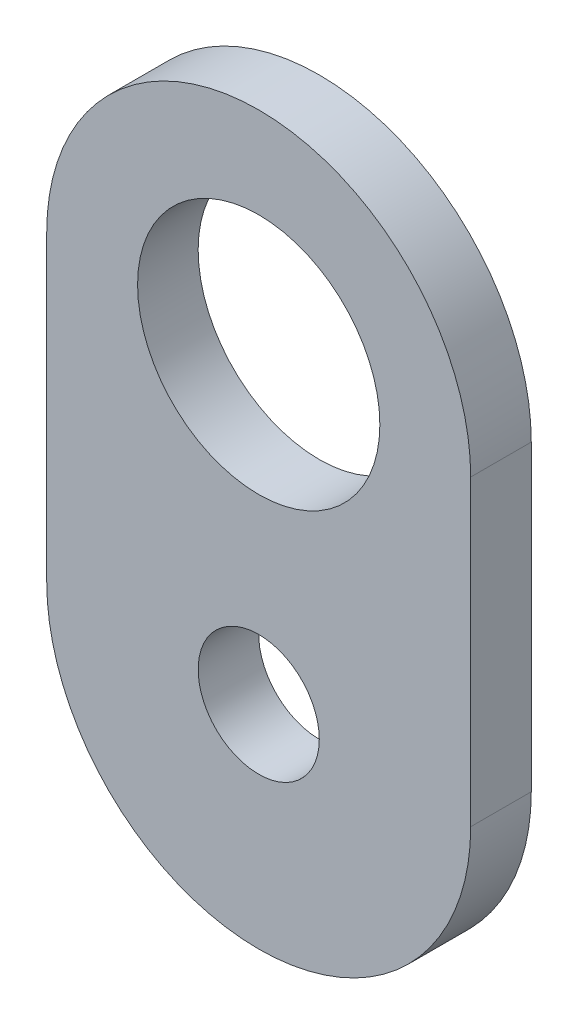
from build123d import *

# Parameters (mm, degrees)
SKETCH1_R           = 25.4
SKETCH1_R_2         = 12.7
BOSS_EXTRUDE1_DEPTH = 12.7


with BuildPart() as part:
    # Sketch1 → Boss-Extrude1 (new body)
    with BuildSketch(Plane.XY):
        with BuildLine():
            Line((-44.45, 206.731564945), (-44.45, 270.231564945))
            ThreePointArc((-44.45, 270.231564945), (0, 314.681564945), (44.45, 270.231564945))
            Line((44.45, 270.231564945), (44.45, 206.731564945))
            ThreePointArc((44.45, 206.731564945), (0, 162.281564945), (-44.45, 206.731564945))
        make_face()
        with Locations((0, 270.231564945)):
            Circle(SKETCH1_R, mode=Mode.SUBTRACT)
        with Locations((0, 206.731564945)):
            Circle(SKETCH1_R_2, mode=Mode.SUBTRACT)
    extrude(amount=BOSS_EXTRUDE1_DEPTH)


solid = part.part
